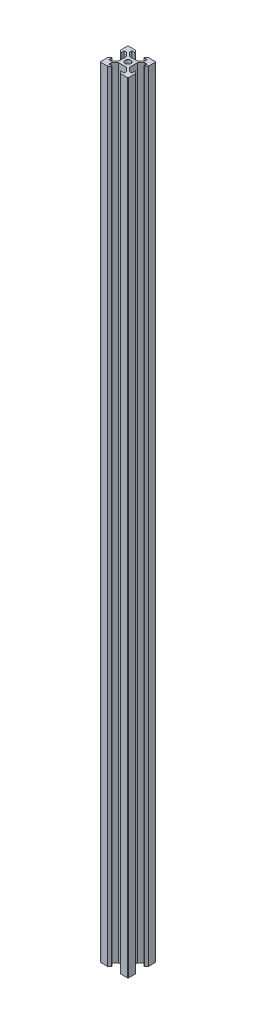
from build123d import *

# Parameters (mm, degrees)
SKETCH2_R              = 2.074585303
VSLOT2020_2020_5_DEPTH = 558.8


with BuildPart() as part:
    # Sketch2 → Vslot2020 2020(5) (new body)
    with BuildSketch(Plane.ZX):
        with BuildLine():
            Line((13.9, 7.149086807), (13.9, 12.844511469))
            Line((13.9, 12.844511469), (16.558493656, 15.492177728))
            Line((16.558493656, 15.492177728), (16.550703242, 15.5))
            Line((16.550703242, 15.5), (18.2, 15.5))
            Line((18.2, 15.5), (18.2, 13.12))
            Line((18.2, 13.12), (18.534428266, 13.12))
            Line((18.534428266, 13.12), (20, 14.58))
            Line((20, 14.58), (20, 19.5))
            ThreePointArc((20, 19.5), (19.853553391, 19.853553391), (19.5, 20))
            Line((19.5, 20), (14.575, 20))
            Line((14.575, 20), (13.12, 18.545))
            Line((13.12, 18.545), (13.12, 18.2))
            Line((13.12, 18.2), (15.5, 18.2))
            Line((15.5, 18.2), (15.5, 16.555))
            Line((15.5, 16.555), (12.834142613, 13.9))
            Line((12.834142613, 13.9), (7.155, 13.9))
            Line((7.155, 13.9), (4.5, 16.555))
            Line((4.5, 16.555), (4.5, 18.2))
            Line((4.5, 18.2), (6.875, 18.2))
            Line((6.875, 18.2), (6.875, 18.545))
            Line((6.875, 18.545), (5.42, 20))
            Line((5.42, 20), (0.5, 20))
            ThreePointArc((0.5, 20), (0.146446609, 19.853553391), (0, 19.5))
            Line((0, 19.5), (0, 14.58))
            Line((0, 14.58), (1.46, 13.12))
            Line((1.46, 13.12), (1.8, 13.12))
            Line((1.8, 13.12), (1.8, 15.5))
            Line((1.8, 15.5), (3.445, 15.5))
            Line((3.445, 15.5), (3.439339828, 15.494339828))
            Line((3.439339828, 15.494339828), (6.094339828, 12.839339828))
            Line((6.094339828, 12.839339828), (6.1, 12.845))
            Line((6.1, 12.845), (6.1, 7.149086807))
            Line((6.1, 7.149086807), (3.439339828, 4.5))
            Line((3.439339828, 4.5), (1.8, 4.5))
            Line((1.8, 4.5), (1.8, 6.88))
            Line((1.8, 6.88), (1.46, 6.88))
            Line((1.46, 6.88), (0, 5.42))
            Line((0, 5.42), (0, 0.5))
            ThreePointArc((0, 0.5), (0.146446609, 0.146446609), (0.5, 0))
            Line((0.5, 0), (5.42, 0))
            Line((5.42, 0), (6.875, 1.455))
            Line((6.875, 1.455), (6.875, 1.8))
            Line((6.875, 1.8), (4.5, 1.8))
            Line((4.5, 1.8), (4.5, 3.4393348))
            Line((4.5, 3.4393348), (7.158345795, 6.086117297))
            Line((7.158345795, 6.086117297), (7.144523479, 6.1))
            Line((7.144523479, 6.1), (12.854625295, 6.1))
            Line((12.854625295, 6.1), (12.841221344, 6.086548451))
            Line((12.841221344, 6.086548451), (15.499715, 3.437461644))
            Line((15.499715, 3.437461644), (15.5, 1.8))
            Line((15.5, 1.8), (13.12, 1.8))
            Line((13.12, 1.8), (13.12, 1.455))
            Line((13.12, 1.455), (14.575, 0))
            Line((14.575, 0), (19.5, 0))
            ThreePointArc((19.5, 0), (19.853553391, 0.146446609), (20, 0.5))
            Line((20, 0.5), (20, 5.42))
            Line((20, 5.42), (18.606904708, 6.88))
            Line((18.606904708, 6.88), (18.2, 6.88))
            Line((18.2, 6.88), (18.2, 4.5))
            Line((18.2, 4.5), (16.558493656, 4.5))
            Line((16.558493656, 4.5), (13.9, 7.149086807))
        make_face()
        with Locations((10, 10)):
            Circle(SKETCH2_R, mode=Mode.SUBTRACT)
    extrude(amount=VSLOT2020_2020_5_DEPTH)


solid = part.part
